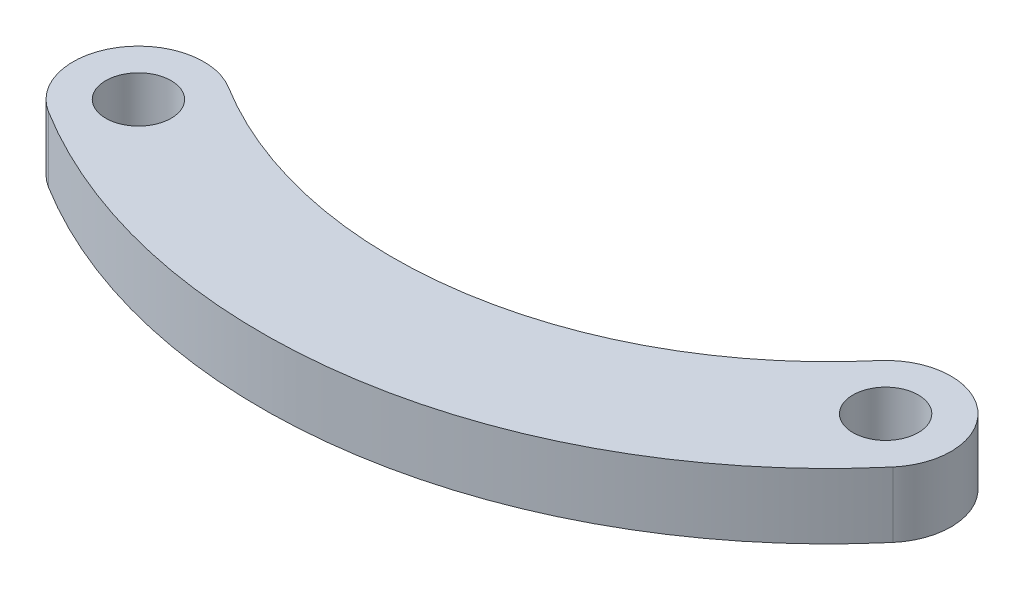
from build123d import *

# Parameters (mm, degrees)
SKETCH1_R           = 9.525
BOSS_EXTRUDE1_DEPTH = 19.05


with BuildPart() as part:
    # Sketch1 → Boss-Extrude1 (new body)
    with BuildSketch(Plane(origin=(0, 0, 0), x_dir=(1, 0, 0), z_dir=(0, 1, 0))):
        with BuildLine():
            ThreePointArc((-86.963279205, -140.340293821), (25.6020793, -163.102861825), (125.779584045, -106.946277343))
            ThreePointArc((125.779584045, -106.946277343), (123.606510195, -80.093293337), (96.753526188, -82.266367187))
            ThreePointArc((96.753526188, -82.266367187), (19.693907154, -125.463739865), (-66.894830158, -107.95407217))
            ThreePointArc((-66.894830158, -107.95407217), (-93.122165507, -114.112958472), (-86.963279205, -140.340293821))
        make_face()
        with Locations(Location((-76.929054682, -124.147182996, 0), (0, 0, 90))):
            Circle(SKETCH1_R, mode=Mode.SUBTRACT)
        with Locations(Location((111.266555117, -94.606322265, 0), (0, 0, 90))):
            Circle(SKETCH1_R, mode=Mode.SUBTRACT)
    extrude(amount=BOSS_EXTRUDE1_DEPTH)


solid = part.part
